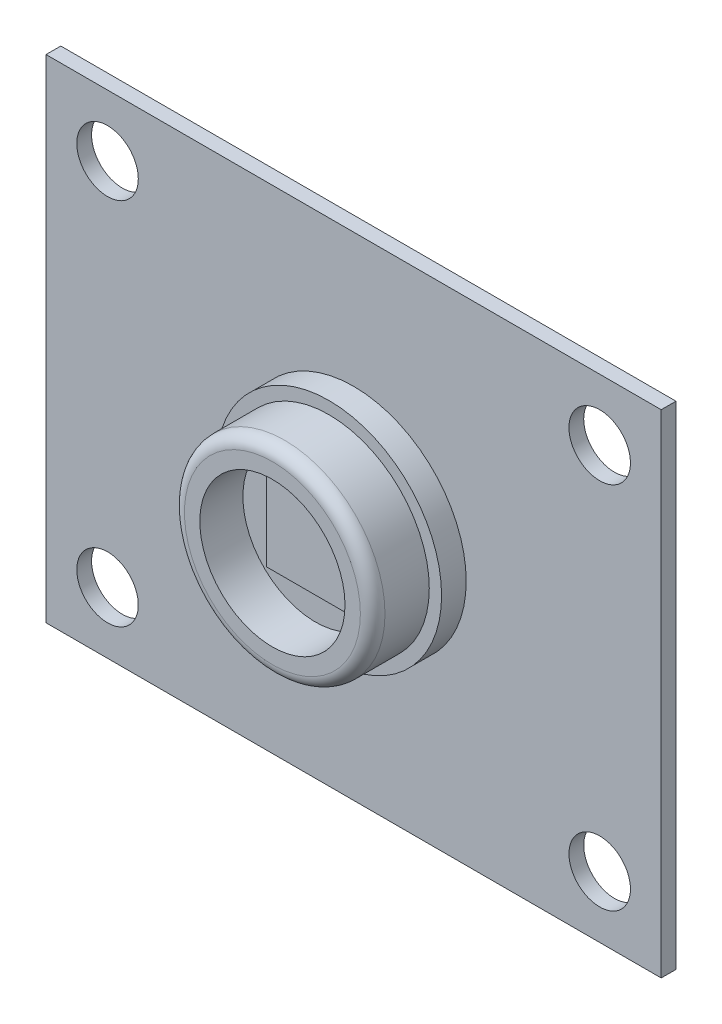
from build123d import *

# Parameters (mm, degrees)
SKETCH1_R           = 4.075
BOSS_EXTRUDE1_DEPTH = 3.3
SKETCH2_R           = 4.575
BOSS_EXTRUDE2_DEPTH = 1
SKETCH3_R           = 2.95
CUT_EXTRUDE1_DEPTH  = 1.75
FILLET1_R           = 0.5
SKETCH5_R           = 0.225
BOSS_EXTRUDE4_DEPTH = 1
SKETCH6_W           = 25
SKETCH6_H           = 20
SKETCH6_R           = 1.25
BOSS_EXTRUDE5_DEPTH = 0.6
ACTIVE_AREA_START   = 1.55
SKETCH7_W           = 3.8
SKETCH7_H           = 3.8
ACTIVE_AREA_DEPTH   = 0.1


with BuildPart() as part:
    # Sketch1 → Boss-Extrude1 (new body)
    with BuildSketch(Plane.XY):
        Circle(SKETCH1_R)
    extrude(amount=-BOSS_EXTRUDE1_DEPTH)

    # Sketch2 → Boss-Extrude2 (add)
    with BuildSketch(Plane(origin=(0, 0, -3.3), x_dir=(-1, 0, 0), z_dir=(0, 0, -1))):
        Circle(SKETCH2_R)
    extrude(amount=-BOSS_EXTRUDE2_DEPTH)

    # Sketch3 → Cut-Extrude1 (cut)
    with BuildSketch(Plane.XY):
        Circle(SKETCH3_R)
    extrude(amount=-CUT_EXTRUDE1_DEPTH, mode=Mode.SUBTRACT)

    # Fillet1
    fillet1_edges = [part.edges().sort_by_distance(p)[0] for p in [
        (-4.075, 0, 0),
    ]]
    fillet(fillet1_edges, radius=FILLET1_R)

    # Sketch5 → Boss-Extrude4 (add)
    with BuildSketch(Plane(origin=(0, 0, -3.3), x_dir=(-1, 0, 0), z_dir=(0, 0, -1))):
        with Locations(Location((2.5, 0, 0), (0, 0, 180))):
            Circle(SKETCH5_R)
        with Locations(Location((-2.5, 0, 0), (0, 0, 180))):
            Circle(SKETCH5_R)
    extrude(amount=BOSS_EXTRUDE4_DEPTH)

    # Sketch6 → Boss-Extrude5 (add)
    with BuildSketch(Plane(origin=(0, 0, -3.3), x_dir=(-1, 0, 0), z_dir=(0, 0, -1))):
        Rectangle(SKETCH6_W, SKETCH6_H)
        with Locations((10, -7.5)):
            Circle(SKETCH6_R, mode=Mode.SUBTRACT)
        with Locations(Location((10, 7.5, 0), (0, 0, 180))):
            Circle(SKETCH6_R, mode=Mode.SUBTRACT)
        with Locations((-10, 7.5)):
            Circle(SKETCH6_R, mode=Mode.SUBTRACT)
        with Locations(Location((-10, -7.5, 0), (0, 0, 180))):
            Circle(SKETCH6_R, mode=Mode.SUBTRACT)
    extrude(amount=BOSS_EXTRUDE5_DEPTH)


with BuildPart() as body_2:
    # Sketch7 → Active_area (new body)
    with BuildSketch(Plane.XY.offset(-3.3).offset(ACTIVE_AREA_START)):
        Rectangle(SKETCH7_W, SKETCH7_H)
    extrude(amount=ACTIVE_AREA_DEPTH)


solid = Compound([part.part, body_2.part])
